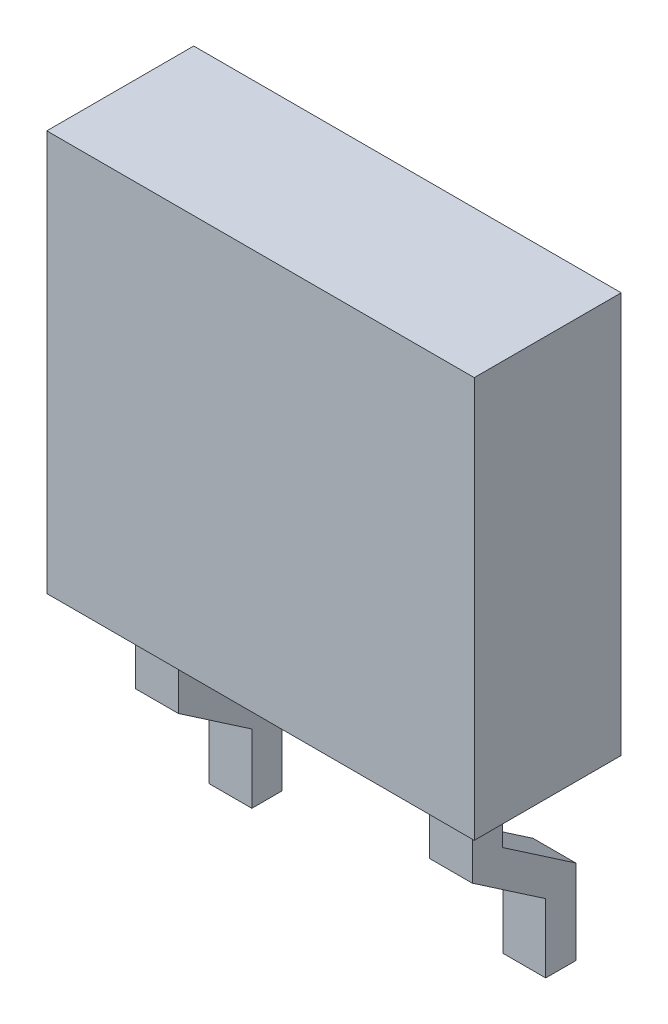
from build123d import *

# Parameters (mm, degrees)
EXTRUSION1_DEPTH        = 2.2
ENL_V_MAT_EXTRU_1_DEPTH = 9.576619381


with BuildPart() as part:
    # Esquisse1 → Extrusion1 (new body)
    with BuildSketch(Plane.XY):
        Polygon((0, 0), (0.68, 0), (0.68, -3), (1.32, -3), (1.32, 0), (5.08, 0), (5.08, -3), (5.72, -3), (5.72, 0), (6.4, 0), (6.4, 6), (0, 6), align=None)
    extrude(amount=EXTRUSION1_DEPTH)

    # Esquisse2 → Enlèv. mat.-Extru.1 (cut, through all)
    with BuildSketch(Plane.ZY.offset(-0.68)):
        Polygon((0.45, -1.971195231), (0.45, -3.327188137), (4.113583834, -3.327188137), (4.113583834, 0), (1.55, 0), (1.55, -1.220350349), align=None)
        Polygon((0, -1.733519979), (0, -3.327188137), (-1.233682365, -3.327188137), (-1.233682365, 0), (1.1, 0), (1.1, -0.982675097), align=None)
    extrude(amount=-ENL_V_MAT_EXTRU_1_DEPTH, mode=Mode.SUBTRACT)


solid = part.part
